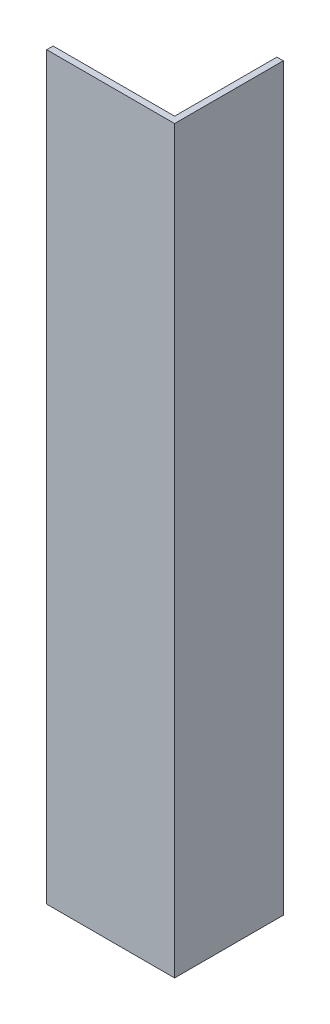
from build123d import *

# Parameters (mm, degrees)
SKETCH1_W           = 6.35
SKETCH1_H           = 734.741844671
BOSS_EXTRUDE1_DEPTH = 107.95
SKETCH2_W           = 6.35
SKETCH2_H           = 734.741844671
BOSS_EXTRUDE2_DEPTH = 120.65


with BuildPart() as part:
    # Sketch1 → Boss-Extrude1 (new body)
    with BuildSketch(Plane.XY):
        with Locations((194.071875, 89.829077665)):
            Rectangle(SKETCH1_W, SKETCH1_H)
    extrude(amount=BOSS_EXTRUDE1_DEPTH)

    # Sketch2 → Boss-Extrude2 (add)
    with BuildSketch(Plane.ZY.offset(-190.896875)):
        with Locations((104.775, 89.829077665)):
            Rectangle(SKETCH2_W, SKETCH2_H)
    extrude(amount=BOSS_EXTRUDE2_DEPTH)


solid = part.part
